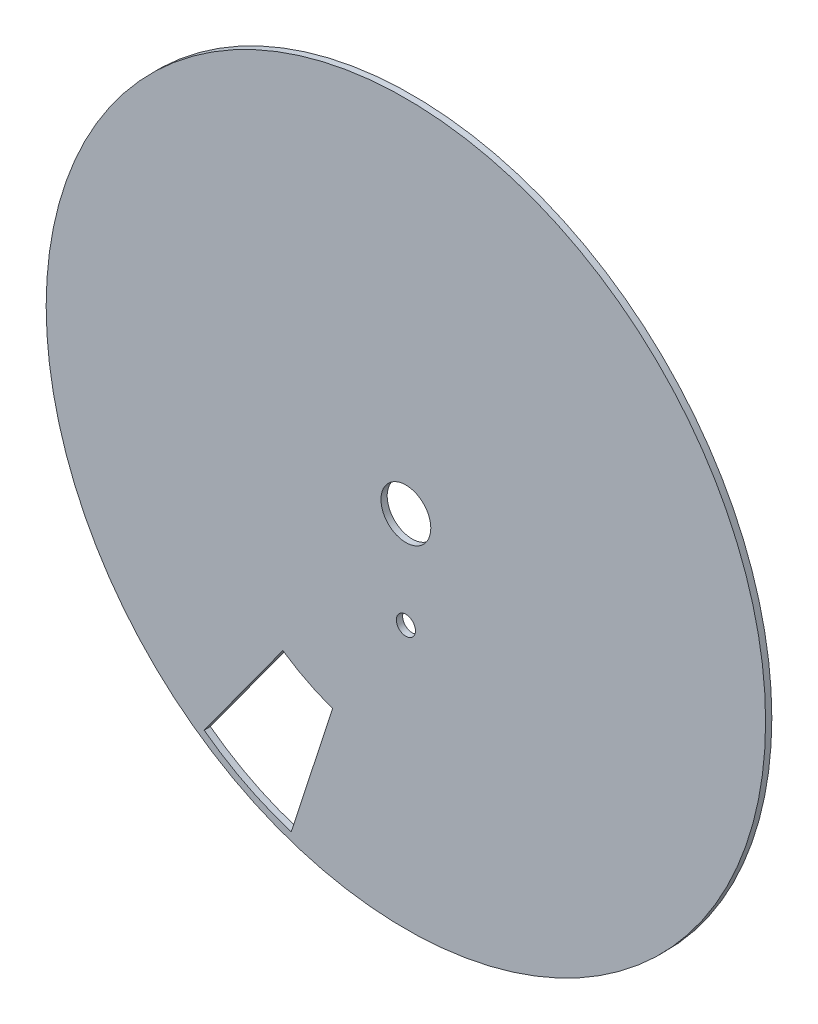
from build123d import *

# Parameters (mm, degrees)
ESQUISSE1_R                  = 57.75
ESQUISSE1_R_2                = 4
BOSS_EXTRU_1_DEPTH           = 1
ENL_V_MAT_EXTRU_1_DEPTH      = 82.676955134
ENL_V_MAT_EXTRU_1_DEPTH_BACK = 82.676955134
ESQUISSE2_R                  = 1.53
ENL_V_MAT_EXTRU_2_DEPTH      = 1


with BuildPart() as part:
    # Esquisse1 → Boss.-Extru.1 (new body)
    with BuildSketch(Plane.XY):
        Circle(ESQUISSE1_R)
        Circle(ESQUISSE1_R_2, mode=Mode.SUBTRACT)
    extrude(amount=BOSS_EXTRU_1_DEPTH)

    # Esquisse2 → Enlèv. mat.-Extru.1 (cut, two sides: drawn at the far end of the back side and taken through both)
    with BuildSketch(Plane(origin=(0, 0, 0), x_dir=(-1, 0, 0), z_dir=(0, 0, -1)).offset(-ENL_V_MAT_EXTRU_1_DEPTH_BACK)):
        with Locations((0, -15.504004846)):
            Circle(ESQUISSE2_R)
    extrude(amount=ENL_V_MAT_EXTRU_1_DEPTH + ENL_V_MAT_EXTRU_1_DEPTH_BACK, mode=Mode.SUBTRACT)

    # Esquisse3 → Enlèv. mat.-Extru.2 (cut)
    with BuildSketch(Plane(origin=(0, 0, 0), x_dir=(-1, 0, 0), z_dir=(0, 0, -1))):
        with BuildLine():
            Line((19.755068189, -28.89182031), (32.389647952, -46.281827468))
            ThreePointArc((32.389647952, -46.281827468), (25.70214401, -50.443439565), (18.405179994, -53.409251489))
            Line((18.405179994, -53.409251489), (11.76223589, -32.96437178))
            ThreePointArc((11.76223589, -32.96437178), (15.889667491, -31.185228347), (19.755068189, -28.89182031))
        make_face()
    extrude(amount=-ENL_V_MAT_EXTRU_2_DEPTH, mode=Mode.SUBTRACT)


solid = part.part
